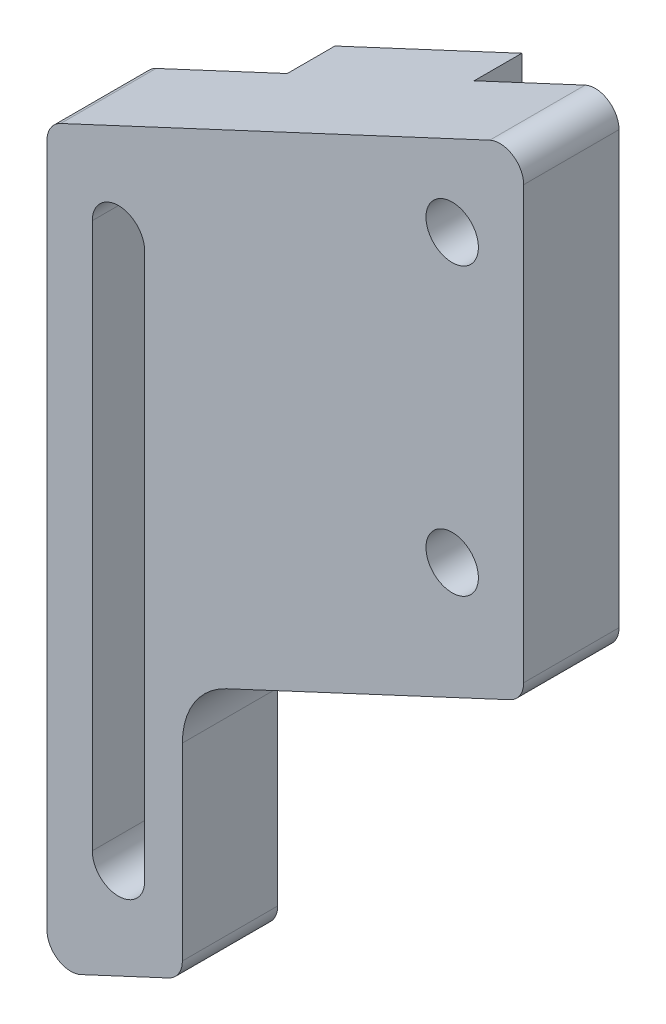
from build123d import *

# Parameters (mm, degrees)
BOSS_EXTRU_1_DEPTH      = 15
ESQUISSE4_OUTSIDE_W     = 74.658
ESQUISSE4_OUTSIDE_H     = 125.21
ENL_V_MAT_EXTRU_2_DEPTH = 5
ENL_V_MAT_EXTRU_3_DEPTH = 114.294624636
ENL_V_START             = -5
ENL_V_MAT_EXTRU_4_DEPTH = 5
CONG_1_R                = 2.5
D_GAGEMENT_M51_D        = 5.5


with BuildPart() as part:
    # Esquisse1 → Boss.-Extru.1 (new body)
    with BuildSketch(Plane.XY):
        Polygon((0, 0), (0, 77.236454327), (50, 100.551837235), (50, 23.315382908), align=None)
        with BuildLine():
            Line((4.75, 13.497307436), (4.75, 70.733761764))
            ThreePointArc((4.75, 70.733761764), (7.5, 73.483761764), (10.25, 70.733761764))
            Line((10.25, 70.733761764), (10.25, 13.497307436))
            ThreePointArc((10.25, 13.497307436), (7.5, 10.747307436), (4.75, 13.497307436))
        make_face(mode=Mode.SUBTRACT)
    extrude(amount=BOSS_EXTRU_1_DEPTH)

    # Esquisse4 outside → Enlèv. mat.-Extru.2 (cut)
    with BuildSketch(Plane(origin=(0, 0, 0), x_dir=(-1, 0, 0), z_dir=(0, 0, -1))):
        with Locations((-25, 50.276)):
            Rectangle(ESQUISSE4_OUTSIDE_W, ESQUISSE4_OUTSIDE_H)
        Polygon((-15.2, 84.324330731), (-15.2, 7.087876404), (-34.8, 16.227506504), (-34.8, 93.463960831), align=None, mode=Mode.SUBTRACT)
    extrude(amount=-ENL_V_MAT_EXTRU_2_DEPTH, mode=Mode.SUBTRACT)

    # Esquisse5 → Enlèv. mat.-Extru.3 (cut, through all)
    with BuildSketch(Plane.XY.offset(15)):
        with BuildLine():
            Line((50, 23.315382908), (50, 49.796452963))
            Line((50, 49.796452963), (18.819053906, 35.256539011))
            ThreePointArc((18.819053906, 35.256539011), (15.452868433, 32.304473581), (14.2, 28.006076714))
            Line((14.2, 28.006076714), (14.2, 6.621568746))
            Line((14.2, 6.621568746), (50, 23.315382908))
        make_face()
    extrude(amount=-ENL_V_MAT_EXTRU_3_DEPTH, mode=Mode.SUBTRACT)

    # Esquisse6 → Enlèv. mat.-Extru.4 (cut)
    with BuildSketch(Plane(origin=(0, 0, 0), x_dir=(-1, 0, 0), z_dir=(0, 0, -1)).offset(ENL_V_START)):
        with BuildLine():
            Line((-18.819053906, 35.256539011), (-15.2, 33.568946459))
            Line((-15.2, 33.568946459), (-15.2, 31.879060061))
            ThreePointArc((-15.2, 31.879060061), (-16.741717169, 33.854764476), (-18.819053906, 35.256539011))
        make_face()
    extrude(amount=ENL_V_MAT_EXTRU_4_DEPTH, mode=Mode.SUBTRACT)

    # Congé1
    cong_1_edges = [part.edges().sort_by_distance(p)[0] for p in [
        (0, 0, 10),
        (0, 77.236454327, 10),
        (50, 100.551837235, 10),
        (14.2, 6.621568746, 10),
        (50, 49.796452963, 10),
    ]]
    fillet(cong_1_edges, radius=CONG_1_R)

    # Dégagement M51 (through all)
    with Locations(Plane(origin=(42.5, 58.554529799, 15), x_dir=(1, 0, 0), z_dir=(0, 0, 1))):
        with Locations((0, 0), (0, 30)):
            Hole(D_GAGEMENT_M51_D / 2)


solid = part.part
